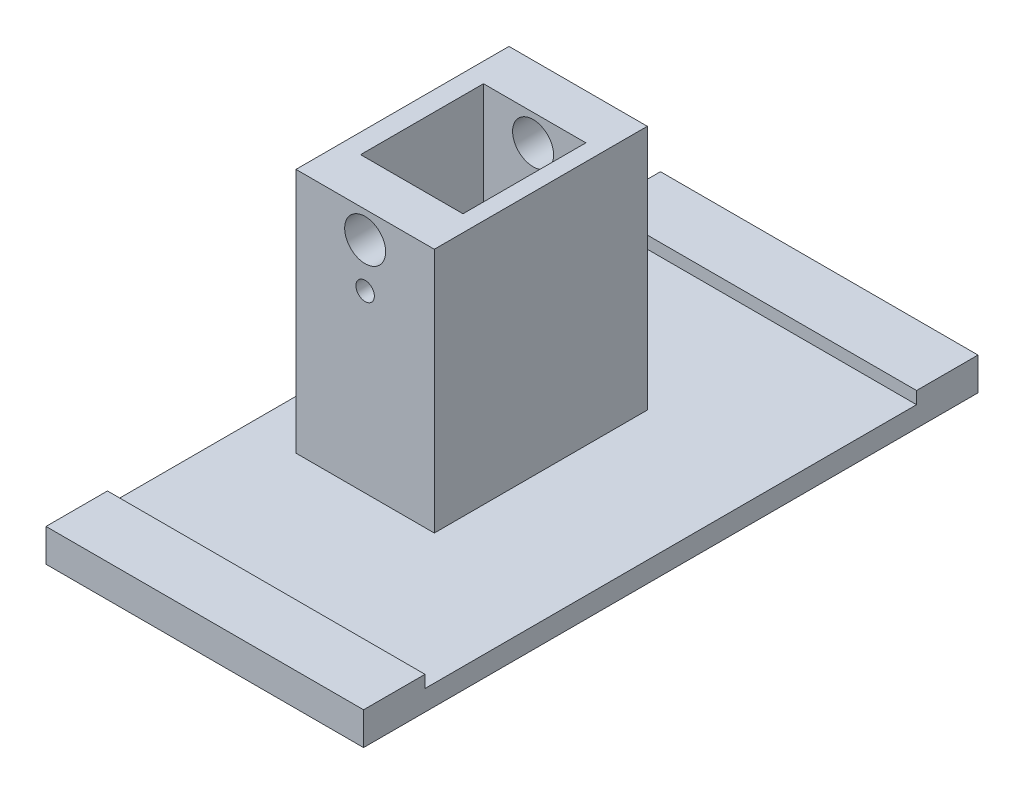
from build123d import *

# Parameters (mm, degrees)
SKETCH2_W             = 39.3827
SKETCH2_H             = 7.62
BOSS_EXTRUDE2_DEPTH   = 4.064
BOSS_EXTRUDE2_2_DEPTH = 4.064
BOSS_EXTRUDE3_DEPTH   = 2.54
BOSS_EXTRUDE4_DEPTH   = 33.02
SKETCH4_W             = 12.7
SKETCH4_H             = 2.54
CUT_EXTRUDE2_DEPTH    = 17.78
CUT_EXTRUDE3_REACH    = 74.621
SKETCH5_R             = 2.54
SKETCH5_R_2           = 1.143


with BuildPart() as part:
    # Sketch2 → Boss-Extrude2 (new body)
    with BuildSketch(Plane(origin=(0, 0, 0), x_dir=(1, 0, 0), z_dir=(0, 1, 0))):
        with Locations((19.69135, 3.81)):
            Rectangle(SKETCH2_W, SKETCH2_H)
    extrude(amount=BOSS_EXTRUDE2_DEPTH)



with BuildPart() as body_2:
    # Sketch2 → Boss-Extrude2 2 (new body)
    with BuildSketch(Plane(origin=(0, 0, 0), x_dir=(1, 0, 0), z_dir=(0, 1, 0))):
        with Locations((19.69135, 72.39)):
            Rectangle(SKETCH2_W, SKETCH2_H)
    extrude(amount=BOSS_EXTRUDE2_2_DEPTH)


with BuildPart() as part_1:
    add(part.part)

    add(body_2.part)  # Boss-Extrude3 merges body 2
    # Sketch2<3> → Boss-Extrude3 (add)
    with BuildSketch(Plane(origin=(0, 0, 0), x_dir=(1, 0, 0), z_dir=(0, 1, 0))):
        with BuildLine():
            Line((0, 34.29), (0, 7.62))
            Line((0, 7.62), (39.3827, 7.62))
            Line((39.3827, 7.62), (39.3827, 68.58))
            Line((39.3827, 68.58), (0, 68.58))
            Line((0, 68.58), (0, 41.91))
            ThreePointArc((0, 41.91), (3.81, 38.1), (0, 34.29))
        make_face()
    extrude(amount=BOSS_EXTRUDE3_DEPTH)

    # Sketch2<8> → Boss-Extrude4 (add)
    with BuildSketch(Plane(origin=(0, 0, 0), x_dir=(1, 0, 0), z_dir=(0, 1, 0))):
        Polygon((6.107856951, 51.308), (6.107856951, 38.1), (6.107856951, 24.892), (23.265414456, 24.892), (23.265414456, 51.308), align=None)
        Polygon((8.533414456, 30.48), (8.533414456, 38.1), (8.533414456, 45.72), (21.233414456, 45.72), (21.233414456, 30.48), align=None, mode=Mode.SUBTRACT)
    extrude(amount=BOSS_EXTRUDE4_DEPTH)

    # Sketch4 → Cut-Extrude2 (cut)
    with BuildSketch(Plane(origin=(0, 2.54, 0), x_dir=(1, 0, 0), z_dir=(0, 1, 0))):
        with Locations((14.883414456, 46.99)):
            Rectangle(SKETCH4_W, SKETCH4_H)
        with Locations((14.883414456, 29.21)):
            Rectangle(SKETCH4_W, SKETCH4_H)
    extrude(amount=CUT_EXTRUDE2_DEPTH, mode=Mode.SUBTRACT)

    # Cut-Extrude3: up to this face of the body (flat: up to its plane)
    cut_extrude3_end = Plane(part_1.part.faces().sort_by_distance((14.686635703, 17.78, -24.892))[0])
    # Sketch5 → Cut-Extrude3 (cut, up to the picked face)
    with BuildSketch(Plane(origin=(0, 0, -51.308), x_dir=(-1, 0, 0), z_dir=(0, 0, -1)), mode=Mode.PRIVATE) as cut_extrude3_sk1:
        with Locations((-14.686635703, 29.718)):
            Circle(SKETCH5_R)
    cut_extrude3_tool1 = split(extrude(cut_extrude3_sk1.sketch, amount=-CUT_EXTRUDE3_REACH, mode=Mode.PRIVATE), bisect_by=cut_extrude3_end, keep=Keep.BOTH, mode=Mode.PRIVATE)
    # Sketch5 → Cut-Extrude3 (cut, up to the picked face)
    with BuildSketch(Plane(origin=(0, 0, -51.308), x_dir=(-1, 0, 0), z_dir=(0, 0, -1)), mode=Mode.PRIVATE) as cut_extrude3_sk2:
        with Locations((-14.686635703, 24.257)):
            Circle(SKETCH5_R_2)
    cut_extrude3_tool2 = split(extrude(cut_extrude3_sk2.sketch, amount=-CUT_EXTRUDE3_REACH, mode=Mode.PRIVATE), bisect_by=cut_extrude3_end, keep=Keep.BOTH, mode=Mode.PRIVATE)
    add(cut_extrude3_tool1.solids().sort_by(Axis((14.686636, 29.718, -51.308), (0, 0, 1)))[0], mode=Mode.SUBTRACT)
    add(cut_extrude3_tool2.solids().sort_by(Axis((14.686636, 24.257, -51.308), (0, 0, 1)))[0], mode=Mode.SUBTRACT)


solid = part_1.part
